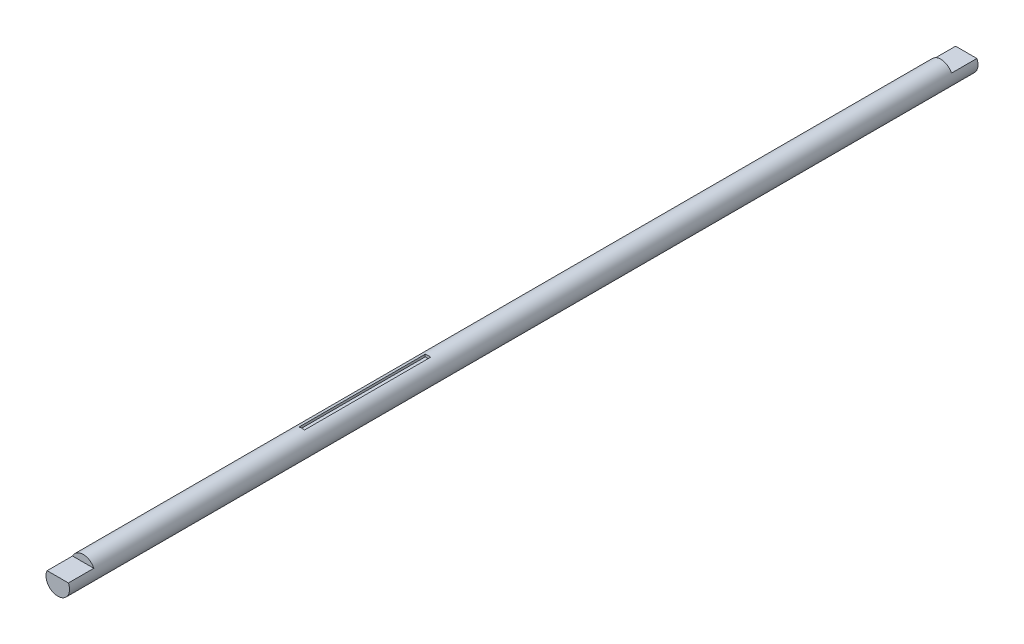
from build123d import *

# Parameters (mm, degrees)
SKETCH1_R           = 7
BOSS_EXTRUDE1_DEPTH = 270
CUT_EXTRUDE1_DEPTH  = 15.1
CUT_EXTRUDE2_START  = -145
SKETCH3_W           = 3.175
SKETCH3_H           = 3.175
CUT_EXTRUDE2_DEPTH  = 75


with BuildPart() as part:
    # Sketch1 → Boss-Extrude1 (new, symmetric)
    with BuildSketch(Plane.XY):
        Circle(SKETCH1_R)
    extrude(amount=BOSS_EXTRUDE1_DEPTH, both=True)

    # Sketch2 → Cut-Extrude1 (cut)
    with BuildSketch(Plane.XY.offset(270)):
        with BuildLine():
            Line((-6.32455532, 3), (6.32455532, 3))
            ThreePointArc((6.32455532, 3), (0, 7), (-6.32455532, 3))
        make_face()
    cut_extrude1 = extrude(amount=-CUT_EXTRUDE1_DEPTH, mode=Mode.SUBTRACT)

    # Sketch3 → Cut-Extrude2 (cut)
    with BuildSketch(Plane.XY.offset(270).offset(CUT_EXTRUDE2_START)):
        with Locations((0, 7)):
            Rectangle(SKETCH3_W, SKETCH3_H)
    extrude(amount=-CUT_EXTRUDE2_DEPTH, mode=Mode.SUBTRACT)

    # Mirror1: Cut-Extrude1 across plane
    add(cut_extrude1.mirror(Plane.XY), mode=Mode.SUBTRACT)


solid = part.part
